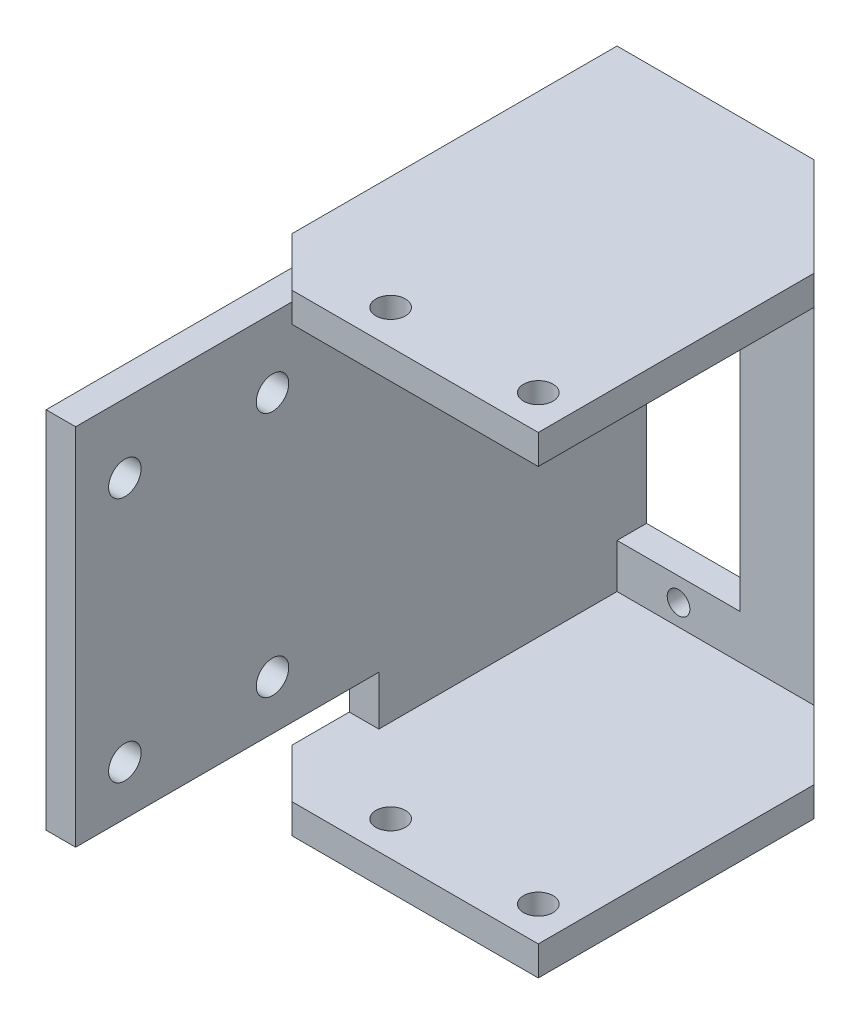
from build123d import *

# Parameters (mm, degrees)
SKETCH_1_W           = 30
SKETCH_1_H           = 48
EXTRUDE_1_DEPTH      = 3
SKETCH_3_W           = 30
SKETCH_3_H           = 3
EXTRUDE_2_DEPTH      = 35
CUT_EXTRUDE_2_DEPTH  = 69.176242196
CUT_EXTRUDE_3_DEPTH  = 69.176242196
SKETCH_7_W           = 3
SKETCH_7_H           = 42
EXTRUDE_3_DEPTH      = 25
SKETCH_14_W          = 3
SKETCH_14_H          = 42
EXTRUDE_6_DEPTH      = 30
SKETCH_15_R          = 1.65
CUT_EXTRUDE_6_DEPTH  = 4
SKETCH_16_R          = 1.15
SKETCH_16_W          = 12.5
SKETCH_16_H          = 23
CUT_EXTRUDE_7_DEPTH  = 10
SKETCH_17_W          = 30.8
SKETCH_17_H          = 5
CUT_EXTRUDE_8_DEPTH  = 10
SKETCH_20_R          = 1.5
CUT_EXTRUDE_11_DEPTH = 82.043198357
CUT_EXTRUDE_12_REACH = 83.043
SKETCH_22_R          = 2
SKETCH_23_W          = 5.554421841
SKETCH_23_H          = 4.674351411
SKETCH_23_R          = 2
EXTRUDE_9_DEPTH      = 3


with BuildPart() as part:
    # 草图1 → 凸台-拉伸1 (new body)
    with BuildSketch(Plane.XY):
        with Locations((15, 24)):
            Rectangle(SKETCH_1_W, SKETCH_1_H)
    extrude(amount=EXTRUDE_1_DEPTH)

    # 草图3 → 凸台-拉伸2 (add)
    with BuildSketch(Plane.XY.offset(3)):
        with Locations((15, 46.5)):
            Rectangle(SKETCH_3_W, SKETCH_3_H)
        with Locations((15, 1.5)):
            Rectangle(SKETCH_3_W, SKETCH_3_H)
    extrude(amount=EXTRUDE_2_DEPTH)

    # 草图5 → 切除-拉伸2 (cut, through all)
    with BuildSketch(Plane.XZ):
        Polygon((0, 33), (5, 38), (0, 38), align=None)
    extrude(amount=-CUT_EXTRUDE_2_DEPTH, mode=Mode.SUBTRACT)

    # 草图6 → 切除-拉伸3 (cut, through all)
    with BuildSketch(Plane.XZ):
        Polygon((20, 0), (30, 10), (30, 0), align=None)
    extrude(amount=-CUT_EXTRUDE_3_DEPTH, mode=Mode.SUBTRACT)

    # 草图7 → 凸台-拉伸3 (add)
    with BuildSketch(Plane.XY.offset(3)):
        with Locations((1.5, 24)):
            Rectangle(SKETCH_7_W, SKETCH_7_H)
    extrude(amount=EXTRUDE_3_DEPTH)

    # 草图14 → 凸台-拉伸6 (add)
    with BuildSketch(Plane.XY.offset(28)):
        with Locations((1.5, 24)):
            Rectangle(SKETCH_14_W, SKETCH_14_H)
    extrude(amount=EXTRUDE_6_DEPTH)

    # 草图15 → 切除-拉伸6 (cut)
    with BuildSketch(Plane.ZY):
        with Locations(Location((38, 13, 0), (0, 0, 270))):
            Circle(SKETCH_15_R)
        with Locations(Location((38, 38, 0), (0, 0, 270))):
            Circle(SKETCH_15_R)
        with Locations(Location((53, 38, 0), (0, 0, 270))):
            Circle(SKETCH_15_R)
        with Locations(Location((53, 13, 0), (0, 0, 270))):
            Circle(SKETCH_15_R)
    extrude(amount=-CUT_EXTRUDE_6_DEPTH, mode=Mode.SUBTRACT)

    # 草图16 → 切除-拉伸7 (cut)
    with BuildSketch(Plane.XY.offset(3)):
        with Locations((9.25, 32.85)):
            Circle(SKETCH_16_R)
        with Locations((9.25, 5.15)):
            Circle(SKETCH_16_R)
        with Locations((9.25, 19)):
            Rectangle(SKETCH_16_W, SKETCH_16_H)
    extrude(amount=-CUT_EXTRUDE_7_DEPTH, mode=Mode.SUBTRACT)

    # 草图17 → 切除-拉伸8 (cut)
    with BuildSketch(Plane.ZY):
        with Locations((42.6, 5.5)):
            Rectangle(SKETCH_17_W, SKETCH_17_H)
    extrude(amount=-CUT_EXTRUDE_8_DEPTH, mode=Mode.SUBTRACT)

    # 草图20 → 切除-拉伸11 (cut, through all)
    with BuildSketch(Plane.XZ):
        with Locations(Location((26.5, 34.5, 0), (0, 0, 270))):
            Circle(SKETCH_20_R)
        with Locations(Location((11.5, 34.5, 0), (0, 0, 270))):
            Circle(SKETCH_20_R)
    extrude(amount=-CUT_EXTRUDE_11_DEPTH, mode=Mode.SUBTRACT)

    # 草图22 → 切除-拉伸12 (cut, up to next)
    with BuildSketch(Plane(origin=(0, 0, 0), x_dir=(-1, 0, 0), z_dir=(0, 0, -1)), mode=Mode.PRIVATE) as cut_extrude_12_sk1:
        with Locations((-9.25, 37.75)):
            Circle(SKETCH_22_R)
    cut_extrude_12_tool1 = extrude(cut_extrude_12_sk1.sketch, amount=-CUT_EXTRUDE_12_REACH, mode=Mode.PRIVATE) & part.part
    add(cut_extrude_12_tool1.solids().sort_by_distance((9.25, 37.75, 0))[0], mode=Mode.SUBTRACT)

    # 草图23 → 凸台-拉伸9 (add)
    with BuildSketch(Plane.XY.offset(3)):
        with Locations((9.150966926, 37.89409872)):
            Rectangle(SKETCH_23_W, SKETCH_23_H)
        with Locations(Location((9.25, 37.75, 0), (0, 0, 180))):
            Circle(SKETCH_23_R, mode=Mode.SUBTRACT)
    extrude(amount=EXTRUDE_9_DEPTH)


solid = part.part
